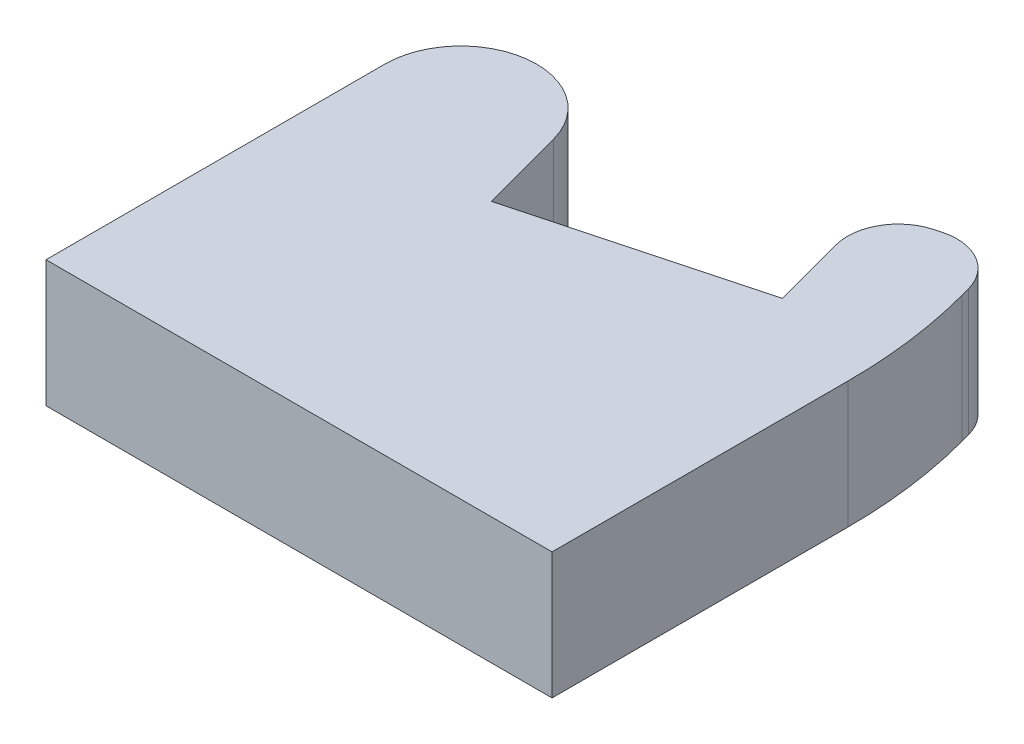
from build123d import *

# Parameters (mm, degrees)
BOSS_EXTRUDE1_DEPTH = 6.35


with BuildPart() as part:
    # Sketch1 → Boss-Extrude1 (new body)
    with BuildSketch(Plane(origin=(0, 0, 0), x_dir=(1, 0, 0), z_dir=(0, 1, 0))):
        with BuildLine():
            Line((0, 0), (25.4, 0))
            Line((25.4, 0), (25.4, 14.863926823))
            ThreePointArc((25.4, 14.863926823), (25.182699479, 18.179292106), (24.534515988, 21.437930569))
            Line((24.534515988, 21.437930569), (24.413899438, 21.88807766))
            ThreePointArc((24.413899438, 21.88807766), (23.230447839, 23.430381811), (21.303047465, 23.684128884))
            Line((21.303047465, 23.684128884), (20.977173177, 23.596811132))
            ThreePointArc((20.977173177, 23.596811132), (19.434869026, 22.413359533), (19.181121952, 20.485959159))
            Line((19.181121952, 20.485959159), (20.167222514, 16.80578176))
            Line((20.167222514, 16.80578176), (8.636, 13.716))
            Line((8.636, 13.716), (7.490177398, 17.992268167))
            ThreePointArc((7.490177398, 17.992268167), (3.312695208, 20.783572527), (0, 17.006167605))
            Line((0, 17.006167605), (0, 0))
        make_face()
    extrude(amount=BOSS_EXTRUDE1_DEPTH)


solid = part.part
